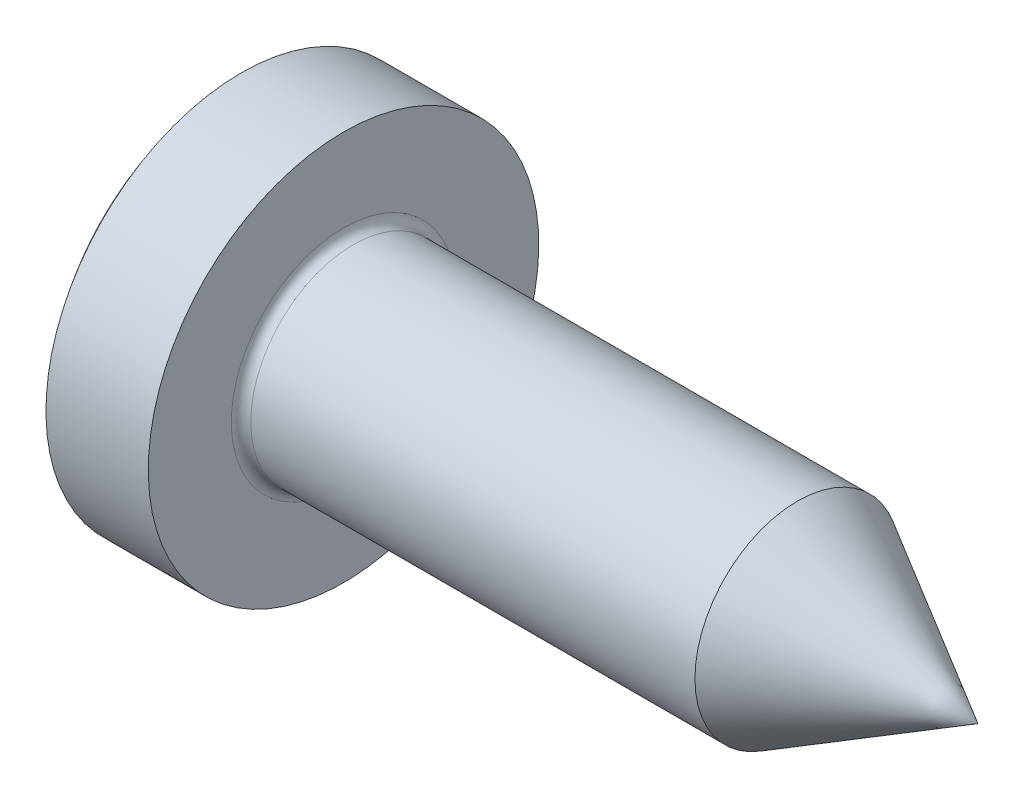
from build123d import *

# Parameters (mm, degrees)
CUT_EXTRUDE_1_REACH = 8.451
FILLET_1_R          = 0.2


with BuildPart() as part:
    # 草图2 → 旋转1 (revolve)
    with BuildSketch(Plane.XY):
        with BuildLine():
            Line((0, 0), (0, 4))
            Line((0, 4), (-2.097282132, 4))
            ThreePointArc((-2.097282132, 4), (-2.672376759, 3.126707508), (-3.1, 2.1725))
            Line((-3.1, 2.1725), (-3.1, 0))
            Line((-3.1, 0), (0, 0))
        make_face()
    revolve(axis=Axis((0, 0, 0), (-1, 0, 0)))

    # 草图3 → 切除-拉伸1 (cut, up to next)
    with BuildSketch(Plane(origin=(0, 0, 0), x_dir=(0, 0, -1), z_dir=(1, 0, 0)), mode=Mode.PRIVATE) as cut_extrude_1_sk1:
        with BuildLine():
            ThreePointArc((-0.476528859, 1.6908006), (0, 1.975), (0.476528859, 1.6908006))
            ThreePointArc((0.476528859, 1.6908006), (0.79, 1.368320138), (1.226011842, 1.258086397))
            ThreePointArc((1.226011842, 1.258086397), (1.710400172, 0.9875), (1.702540702, 0.432714202))
            ThreePointArc((1.702540702, 0.432714202), (1.58, 0), (1.702540702, -0.432714202))
            ThreePointArc((1.702540702, -0.432714202), (1.710400172, -0.9875), (1.226011842, -1.258086397))
            ThreePointArc((1.226011842, -1.258086397), (0.79, -1.368320138), (0.476528859, -1.6908006))
            ThreePointArc((0.476528859, -1.6908006), (0, -1.975), (-0.476528859, -1.6908006))
            ThreePointArc((-0.476528859, -1.6908006), (-0.79, -1.368320138), (-1.226011842, -1.258086397))
            ThreePointArc((-1.226011842, -1.258086397), (-1.710400172, -0.9875), (-1.702540702, -0.432714202))
            ThreePointArc((-1.702540702, -0.432714202), (-1.58, 0), (-1.702540702, 0.432714202))
            ThreePointArc((-1.702540702, 0.432714202), (-1.710400172, 0.9875), (-1.226011842, 1.258086397))
            ThreePointArc((-1.226011842, 1.258086397), (-0.79, 1.368320138), (-0.476528859, 1.6908006))
        make_face()
    cut_extrude_1_tool1 = extrude(cut_extrude_1_sk1.sketch, amount=-CUT_EXTRUDE_1_REACH, mode=Mode.PRIVATE) & part.part
    add(cut_extrude_1_tool1.solids().sort_by_distance((0, 0, 0))[0], mode=Mode.SUBTRACT)

    # 草图4 → 旋转2 (revolve)
    with BuildSketch(Plane.XY, mode=Mode.PRIVATE) as revolve_2_sk:
        Polygon((0, 1.975), (-1.3, 1.975), (-0.159733218, 0), (0, 0), align=None)
    revolve(revolve_2_sk.sketch.rotate(Axis((0, 0, 0), (-1, 0, 0)), 270), axis=Axis((0, 0, 0), (-1, 0, 0)))

    # 切除-拉伸2 cone 1 section (through the dimple's axis) → 切除-拉伸2 (revolve, cut)
    with BuildSketch(Plane(origin=(-3.1, 0, 0), x_dir=(0, 0, 1), z_dir=(0, 1, 0))):
        Polygon((0, 0), (2.1725, 0), (0, 1.25429346), align=None)
    revolve(axis=Axis((-3.1, 0, 0), (1, 0, 0)), mode=Mode.SUBTRACT)

    # 草图6 → 旋转3 (revolve)
    with BuildSketch(Plane.XY, mode=Mode.PRIVATE) as revolve_3_sk:
        Polygon((0, 2.1), (9.3, 2.1), (13, 0), (0, 0), align=None)
    revolve(revolve_3_sk.sketch.rotate(Axis((0, 0, 0), (-1, 0, 0)), 164.260244237), axis=Axis((0, 0, 0), (-1, 0, 0)))

    # 圆角1
    fillet_1_edges = [part.edges().sort_by_distance(p)[0] for p in [
        (0, 2.021257882, 0.569663562),
    ]]
    fillet(fillet_1_edges, radius=FILLET_1_R)


solid = part.part
